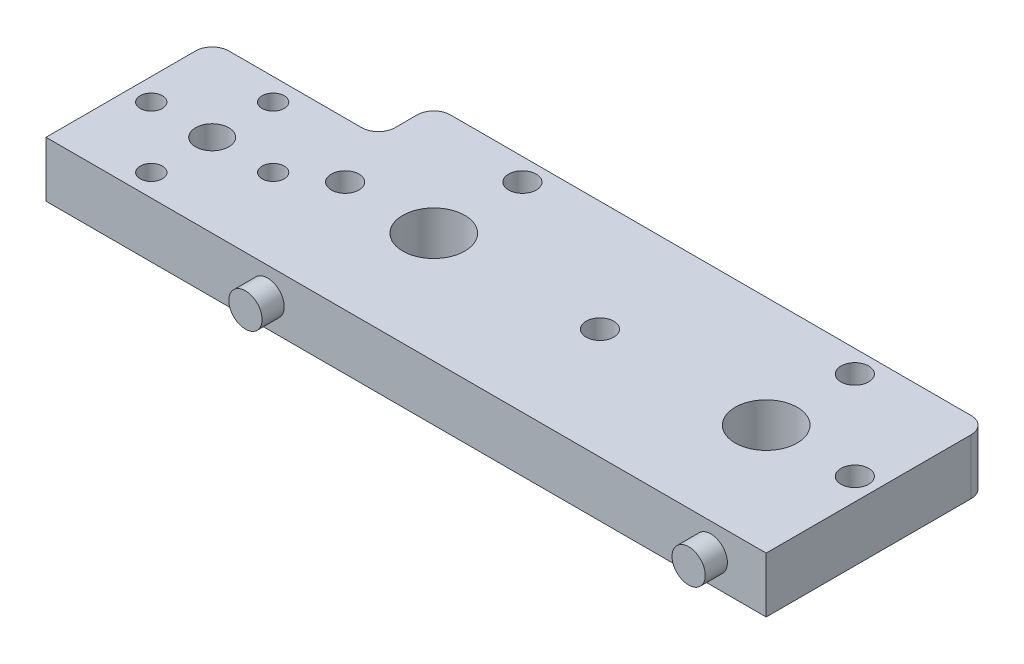
from build123d import *

# Parameters (mm, degrees)
SKETCH_1_W          = 15
SKETCH_1_H          = 15
EXTRUDE_1_DEPTH     = 5
SKETCH_2_R          = 1.25
SKETCH_2_R_2        = 2.8
SKETCH_2_R_3        = 1.5
SKETCH_2_R_4        = 1
CUT_EXTRUDE_1_DEPTH = 5
FILLET_1_R          = 1.5
SKETCH_4_R          = 1.5
EXTRUDE_2_DEPTH     = 2
SKETCH_5_R          = 2
CUT_EXTRUDE_2_DEPTH = 5


with BuildPart() as part:
    # 草图1 → 凸台-拉伸1 (new body)
    with BuildSketch(Plane(origin=(0, 0, 0), x_dir=(1, 0, 0), z_dir=(0, 1, 0))):
        Polygon((25, 10), (-25, 10), (-25, 5), (-25, -10), (25, -10), align=None)
        with Locations((-32.5, -2.5)):
            Rectangle(SKETCH_1_W, SKETCH_1_H)
    extrude(amount=EXTRUDE_1_DEPTH)

    # 草图2 → 切除-拉伸1 (cut)
    with BuildSketch(Plane(origin=(0, 5, 0), x_dir=(1, 0, 0), z_dir=(0, 1, 0))):
        with Locations(Location((0, 0, 0), (0, 0, 270))):
            Circle(SKETCH_2_R)
        with Locations(Location((15, 0, 0), (0, 0, 270))):
            Circle(SKETCH_2_R_2)
        with Locations(Location((-15, 0, 0), (0, 0, 270))):
            Circle(SKETCH_2_R_2)
        with Locations(Location((15, 8, 0), (0, 0, 270))):
            Circle(SKETCH_2_R)
        with Locations(Location((23, 0, 0), (0, 0, 270))):
            Circle(SKETCH_2_R)
        with Locations(Location((-23, 0, 0), (0, 0, 270))):
            Circle(SKETCH_2_R)
        with Locations(Location((-15, 8, 0), (0, 0, 270))):
            Circle(SKETCH_2_R)
        with Locations(Location((-32.5, -2.5, 0), (0, 0, 270))):
            Circle(SKETCH_2_R_3)
        with Locations(Location((-27, -2.5, 0), (0, 0, 270))):
            Circle(SKETCH_2_R_4)
        with Locations(Location((-32.5, -8, 0), (0, 0, 270))):
            Circle(SKETCH_2_R_4)
        with Locations(Location((-38, -2.5, 0), (0, 0, 270))):
            Circle(SKETCH_2_R_4)
        with Locations(Location((-32.5, 3, 0), (0, 0, 270))):
            Circle(SKETCH_2_R_4)
    extrude(amount=-CUT_EXTRUDE_1_DEPTH, mode=Mode.SUBTRACT)

    # 圆角1
    fillet_1_edges = [part.edges().sort_by_distance(p)[0] for p in [
        (-25, 2.5, -5),
        (-40, 2.5, -5),
        (-25, 2.5, -10),
        (25, 2.5, -10),
    ]]
    fillet(fillet_1_edges, radius=FILLET_1_R)

    # 草图4 → 凸台-拉伸2 (add)
    with BuildSketch(Plane.XY.offset(10)):
        with Locations(Location((20, 2.5, 0), (0, 0, 180))):
            Circle(SKETCH_4_R)
        with Locations(Location((-20, 2.5, 0), (0, 0, 180))):
            Circle(SKETCH_4_R)
    extrude(amount=EXTRUDE_2_DEPTH)

    # 草图5 → 切除-拉伸2 (cut)
    with BuildSketch(Plane(origin=(0, 0, -10), x_dir=(-1, 0, 0), z_dir=(0, 0, -1))):
        with Locations((-20, 2.5)):
            Circle(SKETCH_5_R)
        with Locations(Location((20, 2.5, 0), (0, 0, 180))):
            Circle(SKETCH_5_R)
    extrude(amount=-CUT_EXTRUDE_2_DEPTH, mode=Mode.SUBTRACT)


solid = part.part
